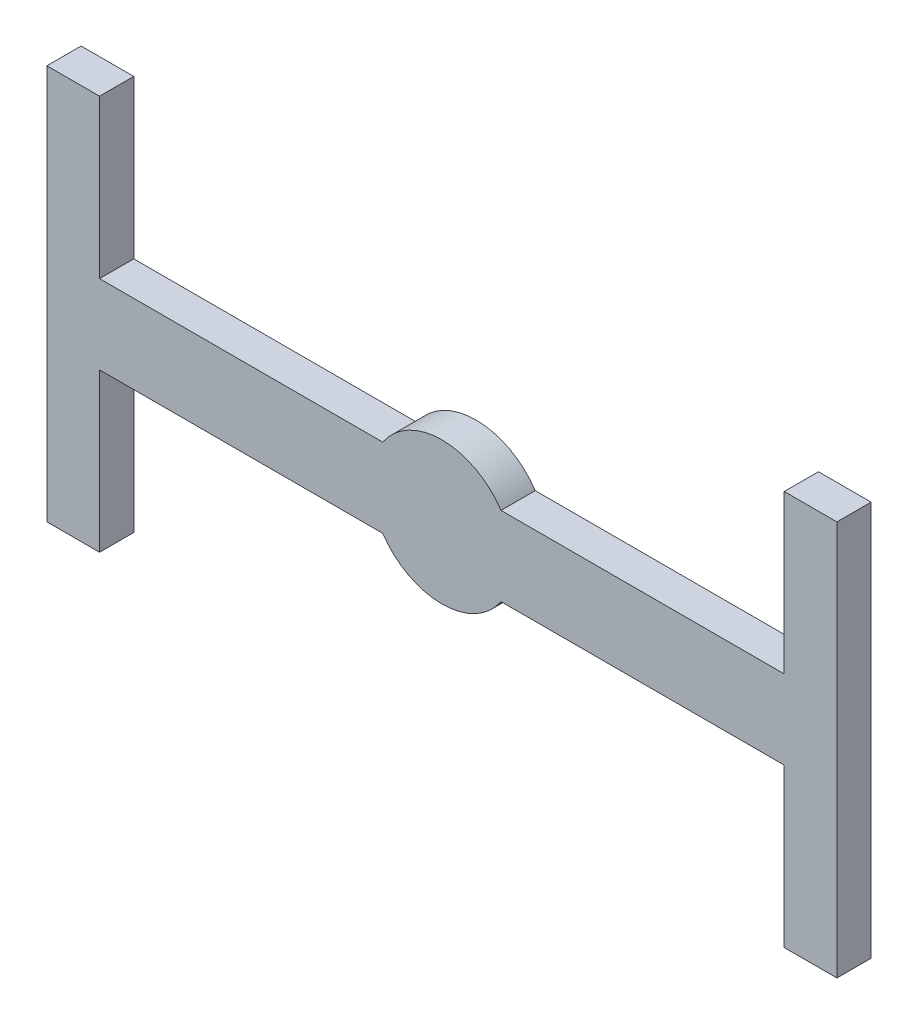
from build123d import *

# Parameters (mm, degrees)
ESQUISSE1_W             = 3000
ESQUISSE1_H             = 1500
BOSS_EXTRU_1_DEPTH      = 130
ENL_V_MAT_EXTRU_1_DEPTH = 130


with BuildPart() as part:
    # Esquisse1 → Boss.-Extru.1 (new body)
    with BuildSketch(Plane.XY):
        with Locations((1500, 750)):
            Rectangle(ESQUISSE1_W, ESQUISSE1_H)
    extrude(amount=-BOSS_EXTRU_1_DEPTH)

    # Esquisse4 → Enlèv. mat.-Extru.1 (cut)
    with BuildSketch(Plane.XY):
        with BuildLine():
            Line((200, 900), (1275.500556794, 900))
            ThreePointArc((1275.500556794, 900), (1500, 1020), (1724.499443206, 900))
            Line((1724.499443206, 900), (2800, 900))
            Line((2800, 900), (2800, 1500))
            Line((2800, 1500), (200, 1500))
            Line((200, 1500), (200, 900))
        make_face()
        with BuildLine():
            Line((200, 600), (200, 0))
            Line((200, 0), (2800, 0))
            Line((2800, 0), (2800, 600))
            Line((2800, 600), (1724.499443206, 600))
            ThreePointArc((1724.499443206, 600), (1500, 480), (1275.500556794, 600))
            Line((1275.500556794, 600), (200, 600))
        make_face()
    extrude(amount=-ENL_V_MAT_EXTRU_1_DEPTH, mode=Mode.SUBTRACT)


solid = part.part
